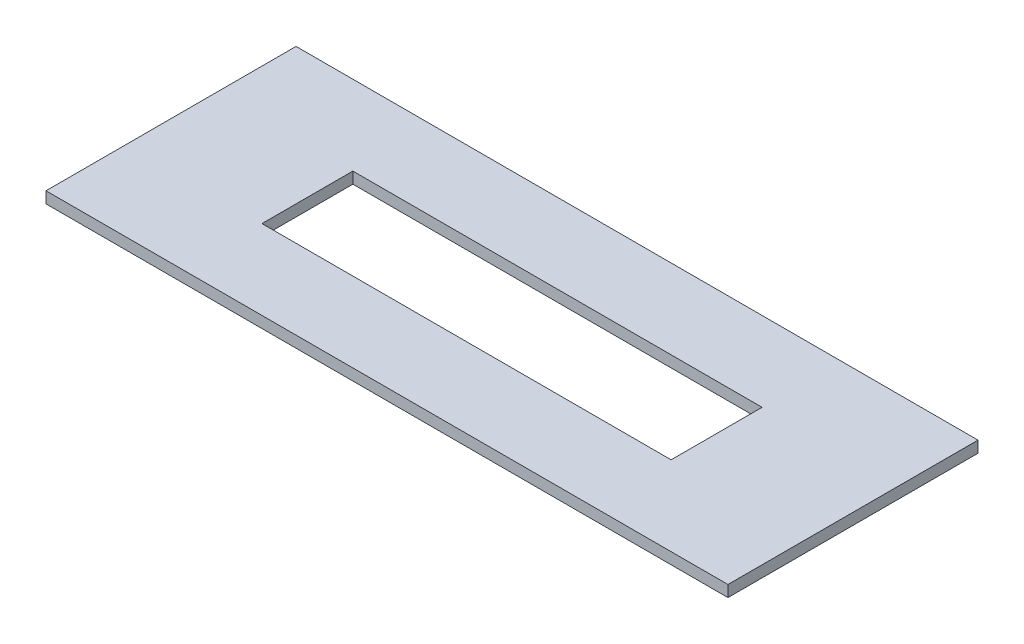
from build123d import *

# Parameters (mm, degrees)
SKETCH1_W           = 47.625
SKETCH1_H           = 17.4625
SKETCH1_W_2         = 28.575
SKETCH1_H_2         = 6.35
BOSS_EXTRUDE1_DEPTH = 0.79375


with BuildPart() as part:
    # Sketch1 → Boss-Extrude1 (new body)
    with BuildSketch(Plane(origin=(0, 0, 0), x_dir=(1, 0, 0), z_dir=(0, 1, 0))):
        Rectangle(SKETCH1_W, SKETCH1_H)
        Rectangle(SKETCH1_W_2, SKETCH1_H_2, mode=Mode.SUBTRACT)
    extrude(amount=BOSS_EXTRUDE1_DEPTH)


solid = part.part
